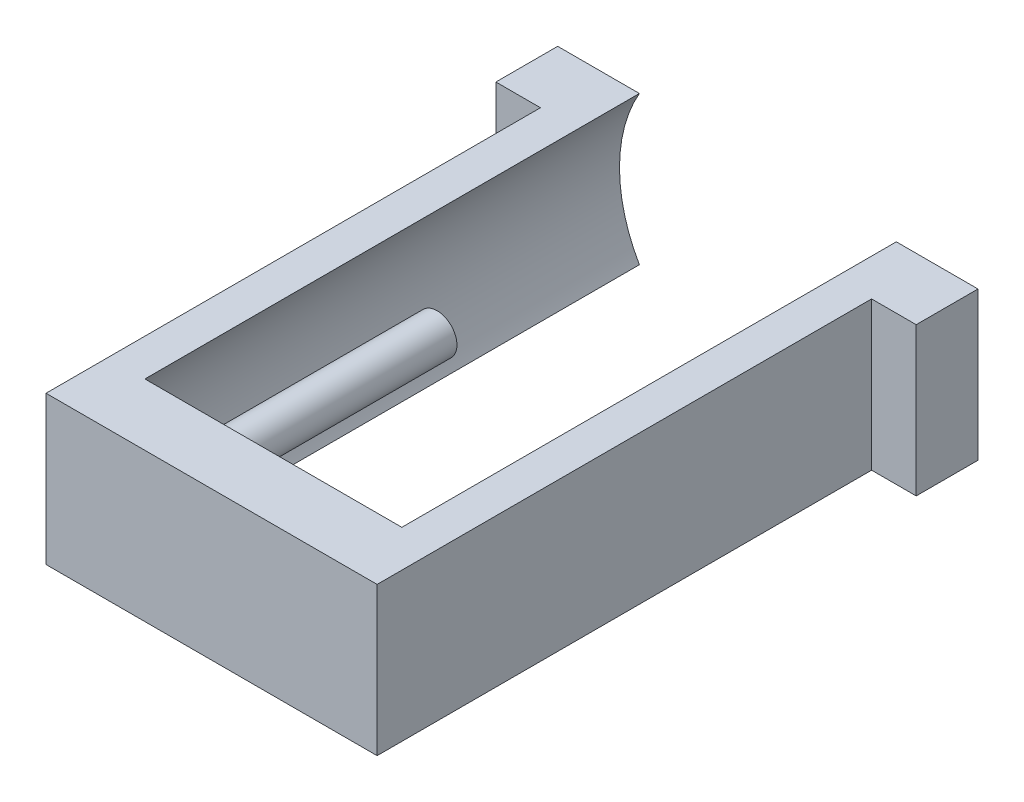
from build123d import *

# Parameters (mm, degrees)
BOSS_EXTRU_2_DEPTH = 5
BOSS_EXTRU_3_DEPTH = 35
ESQUISSE7_W        = 13.392304845
ESQUISSE7_H        = 12
ESQUISSE7_R        = 1.6
BOSS_EXTRU_4_DEPTH = 5
BOSS_EXTRU_5_START = -26
ESQUISSE9_R        = 1.6
BOSS_EXTRU_5_DEPTH = 26


with BuildPart() as part:
    # Esquisse5 → Boss.-Extru.2 (new body)
    with BuildSketch(Plane.XY):
        with BuildLine():
            Line((-17, 6), (-17, -6))
            Line((-17, -6), (-10.392304845, -6))
            ThreePointArc((-10.392304845, -6), (-12, 0), (-10.392304845, 6))
            Line((-10.392304845, 6), (-17, 6))
        make_face()
    boss_extru_2 = extrude(amount=BOSS_EXTRU_2_DEPTH)

    # Esquisse6 → Boss.-Extru.3 (add)
    with BuildSketch(Plane.XY.offset(5)):
        with BuildLine():
            Line((-13.392304845, 6), (-13.392304845, -6))
            Line((-13.392304845, -6), (-10.392304845, -6))
            ThreePointArc((-10.392304845, -6), (-12, 0), (-10.392304845, 6))
            Line((-10.392304845, 6), (-13.392304845, 6))
        make_face()
    boss_extru_3 = extrude(amount=BOSS_EXTRU_3_DEPTH)

    # Esquisse7 → Boss.-Extru.4 (add)
    with BuildSketch(Plane.XY.offset(40)):
        with Locations((-6.696152422, 0)):
            Rectangle(ESQUISSE7_W, ESQUISSE7_H)
        with Locations((-7.75, 0)):
            Circle(ESQUISSE7_R, mode=Mode.SUBTRACT)
    boss_extru_4 = extrude(amount=BOSS_EXTRU_4_DEPTH)

    # Symétrie9: Boss.-Extru.4 across plane
    add(boss_extru_4.mirror(Plane(origin=(0, 0, 0), x_dir=(0, 0, 1), z_dir=(1, 0, 0))))

    # Symétrie10: Boss.-Extru.3 across plane
    add(boss_extru_3.mirror(Plane(origin=(0, 0, 0), x_dir=(0, 0, 1), z_dir=(1, 0, 0))))

    # Symétrie11: Boss.-Extru.2 across plane
    add(boss_extru_2.mirror(Plane(origin=(0, 0, 0), x_dir=(0, 0, 1), z_dir=(1, 0, 0))))

    # Esquisse9 → Boss.-Extru.5 (add)
    with BuildSketch(Plane.XY.offset(45).offset(BOSS_EXTRU_5_START)):
        with Locations((-7.75, 0)):
            Circle(ESQUISSE9_R)
    boss_extru_5 = extrude(amount=BOSS_EXTRU_5_DEPTH)

    # Symétrie12: Boss.-Extru.5 across plane
    add(boss_extru_5.mirror(Plane(origin=(0, 0, 0), x_dir=(0, 0, 1), z_dir=(1, 0, 0))))


solid = part.part
